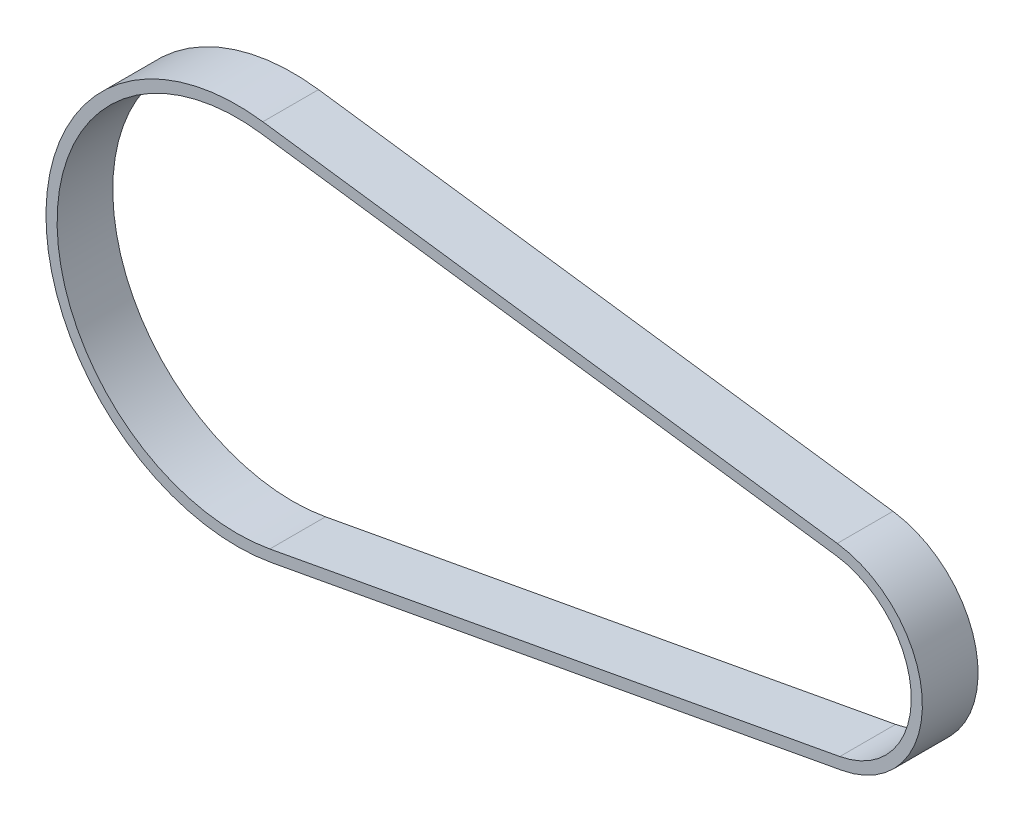
from build123d import *

# Parameters (mm, degrees)
BOSS_EXTRUDE1_DEPTH      = 7.5
BOSS_EXTRUDE1_DEPTH_BACK = 7.5


with BuildPart() as part:
    # Sketch3 → Boss-Extrude1 (new, two sides: drawn at the far end of the back side and taken through both)
    with BuildSketch(Plane.XY.offset(-BOSS_EXTRUDE1_DEPTH_BACK)):
        with BuildLine():
            Line((161.659226047, 30.026745351), (6.927705582, 51.031920357))
            ThreePointArc((6.927705582, 51.031920357), (-51.485381969, -1.22696514), (9.3507776, -50.643982449))
            Line((9.3507776, -50.643982449), (162.906049512, -22.291923083))
            ThreePointArc((162.906049512, -22.291923083), (184.58696244, 4.398952861), (161.659226047, 30.026745351))
        make_face()
        with BuildLine():
            Line((161.255670382, 27.054012126), (6.524149917, 48.059187133))
            ThreePointArc((6.524149917, 48.059187133), (-48.486233505, -1.155491443), (8.806072108, -47.693847549))
            Line((8.806072108, -47.693847549), (162.361344021, -19.341788184))
            ThreePointArc((162.361344021, -19.341788184), (181.587813976, 4.327479163), (161.255670382, 27.054012126))
        make_face(mode=Mode.SUBTRACT)
    extrude(amount=BOSS_EXTRUDE1_DEPTH + BOSS_EXTRUDE1_DEPTH_BACK)


solid = part.part
